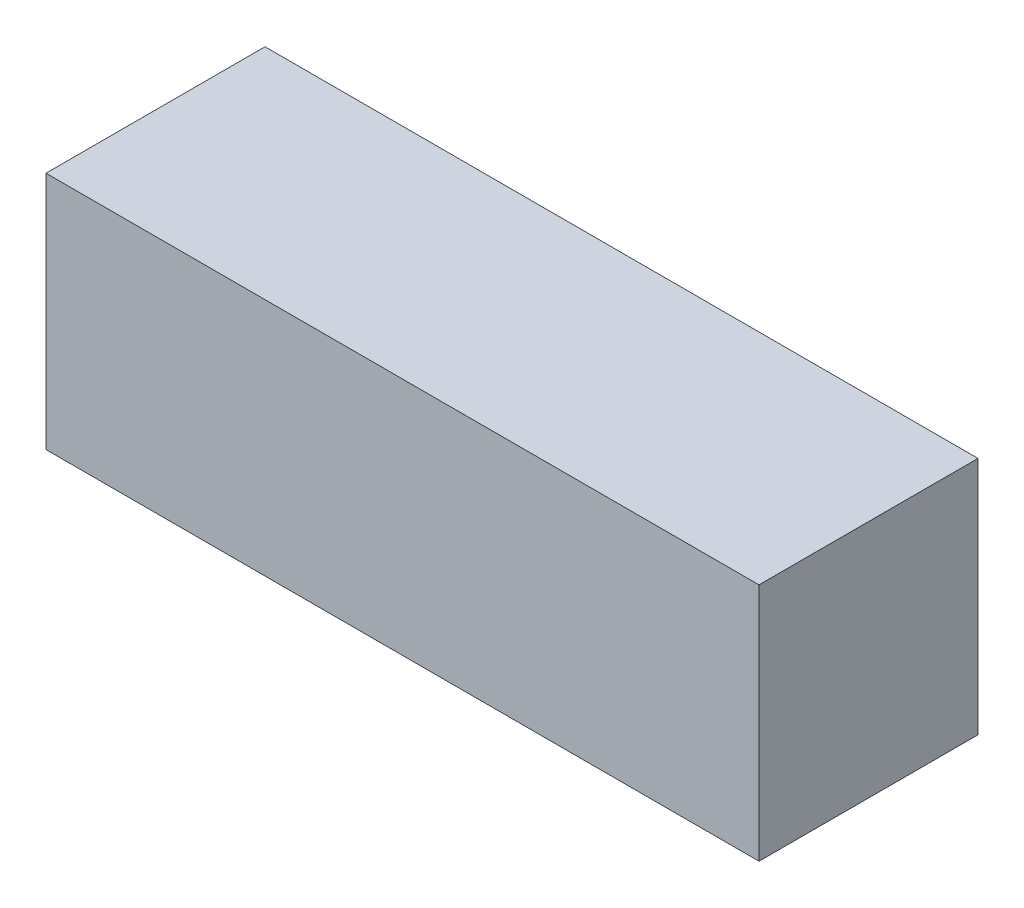
from build123d import *

# Parameters (mm, degrees)
SKETCH1_W           = 140
SKETCH1_H           = 47
BOSS_EXTRUDE1_DEPTH = 43


with BuildPart() as part:
    # Sketch1 → Boss-Extrude1 (new body)
    with BuildSketch(Plane.XY):
        Rectangle(SKETCH1_W, SKETCH1_H)
    extrude(amount=BOSS_EXTRUDE1_DEPTH)


solid = part.part
